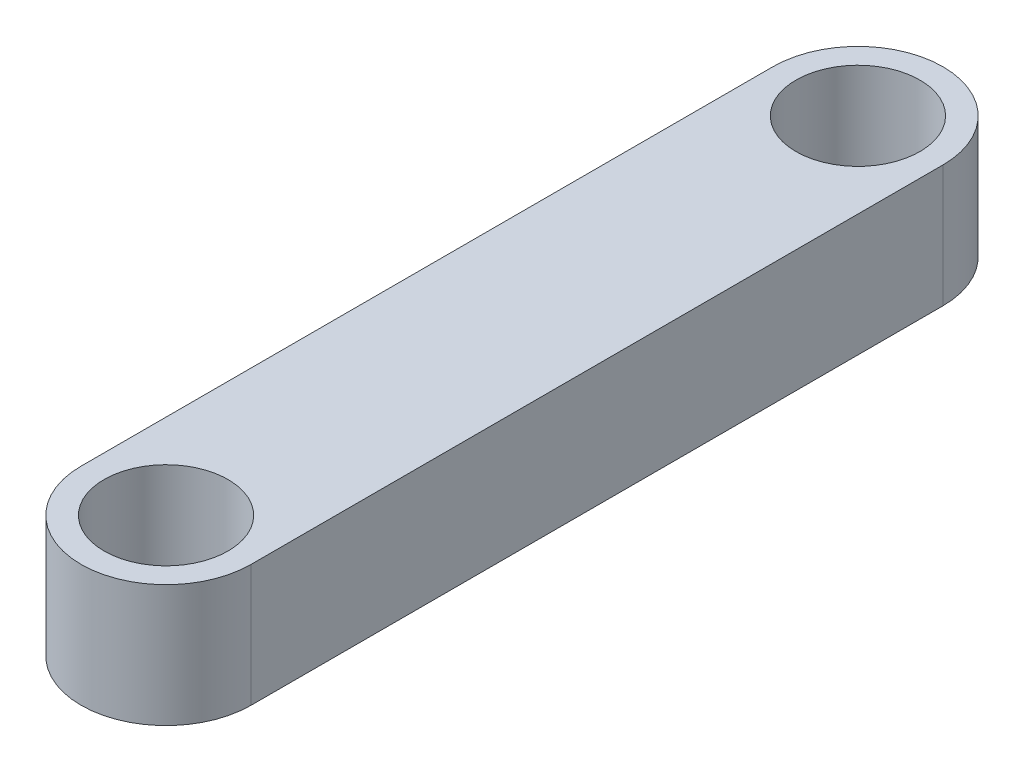
from build123d import *

# Parameters (mm, degrees)
SKETCH1_R           = 3.225
BOSS_EXTRUDE1_DEPTH = 6.35


with BuildPart() as part:
    # Sketch1 → Boss-Extrude1 (new body)
    with BuildSketch(Plane(origin=(0, 0, 0), x_dir=(1, 0, 0), z_dir=(0, 1, 0))):
        with BuildLine():
            ThreePointArc((-4.425, -28), (0, -32.425), (4.425, -28))
            Line((4.425, -28), (4.425, 8))
            ThreePointArc((4.425, 8), (0, 12.425), (-4.425, 8))
            Line((-4.425, 8), (-4.425, -28))
        make_face()
        with Locations((0, -28)):
            Circle(SKETCH1_R, mode=Mode.SUBTRACT)
        with Locations((0, 8)):
            Circle(SKETCH1_R, mode=Mode.SUBTRACT)
    extrude(amount=BOSS_EXTRUDE1_DEPTH)


solid = part.part
